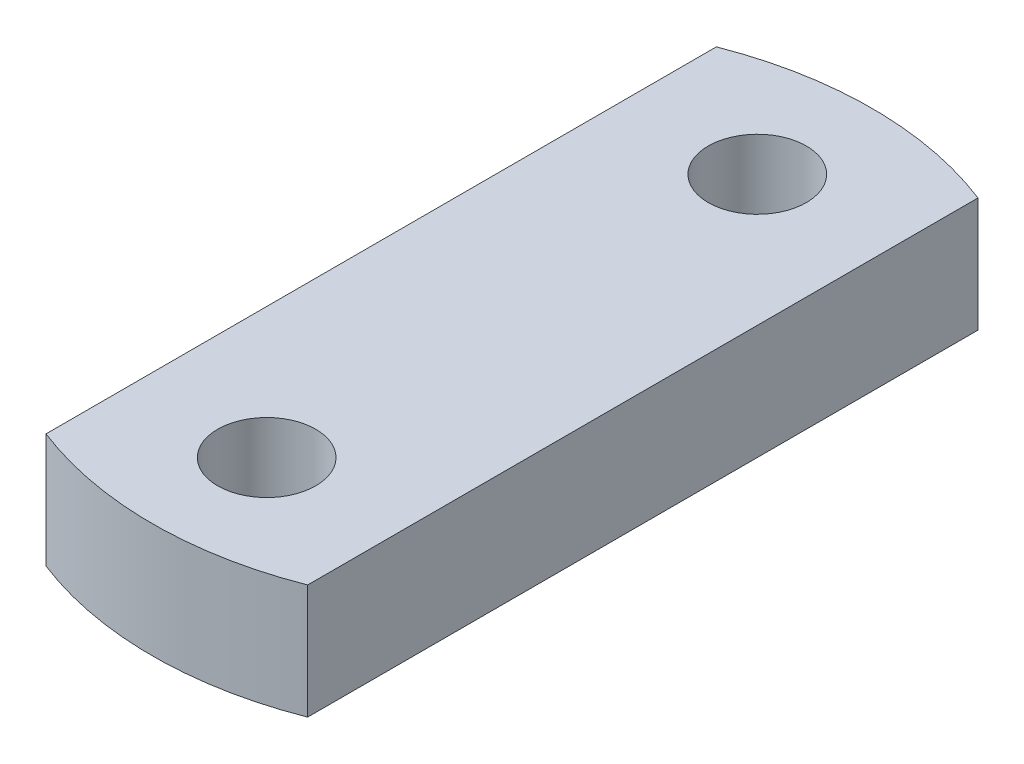
from build123d import *

# Parameters (mm, degrees)
SKETCH1_R           = 15
BOSS_EXTRUDE1_DEPTH = 35


with BuildPart() as part:
    # Sketch1 → Boss-Extrude1 (new body)
    with BuildSketch(Plane(origin=(0, 0, 0), x_dir=(1, 0, 0), z_dir=(0, 1, 0))):
        with BuildLine():
            Line((-40, 102.46950766), (-40, -102.46950766))
            ThreePointArc((-40, -102.46950766), (0, -110), (40, -102.46950766))
            Line((40, -102.46950766), (40, 102.46950766))
            ThreePointArc((40, 102.46950766), (0, 110), (-40, 102.46950766))
        make_face()
        with Locations(Location((0, 75, 0), (0, 0, 270))):
            Circle(SKETCH1_R, mode=Mode.SUBTRACT)
        with Locations(Location((0, -75, 0), (0, 0, 270))):
            Circle(SKETCH1_R, mode=Mode.SUBTRACT)
    extrude(amount=BOSS_EXTRUDE1_DEPTH)


solid = part.part
